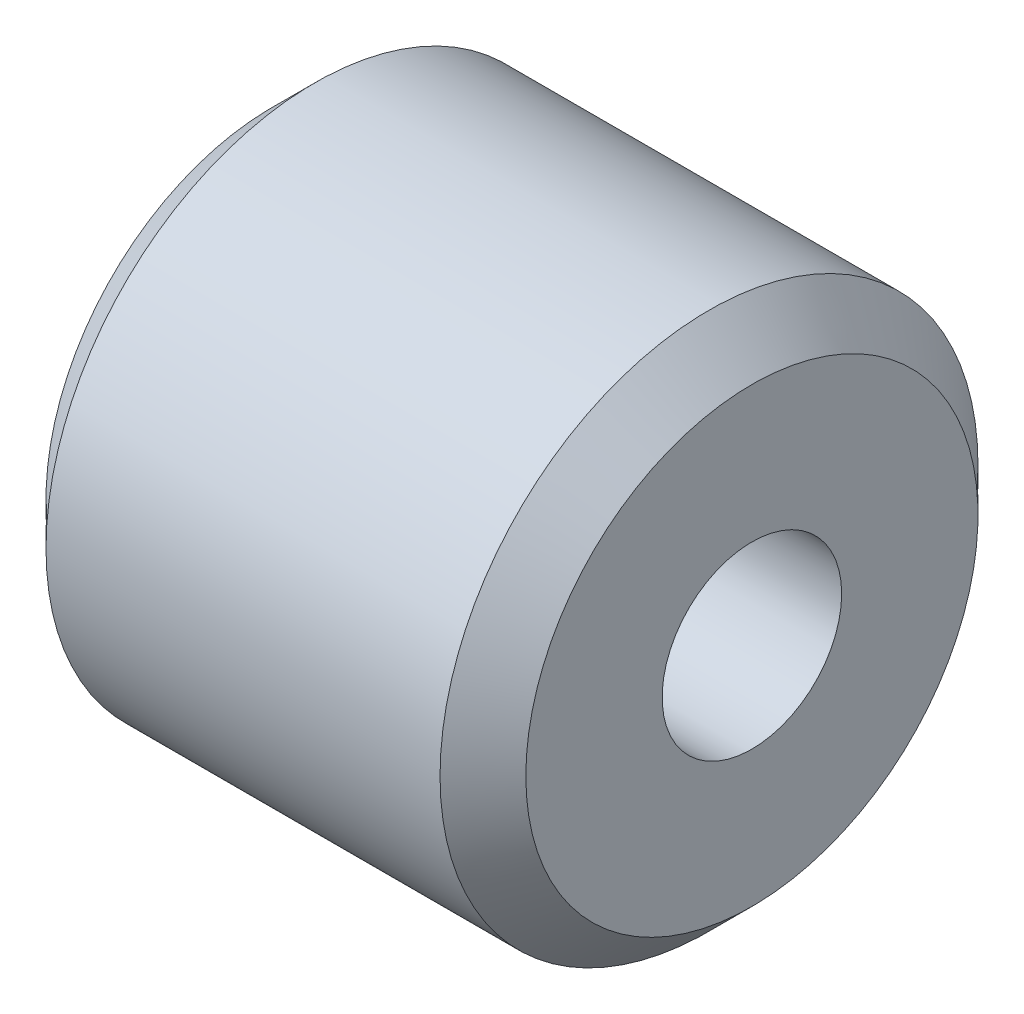
from build123d import *

# Parameters (mm, degrees)
SKETCH1_R           = 4.765
SKETCH1_R_2         = 1.59
BOSS_EXTRUDE1_DEPTH = 4.25
CHAMFER1_SIZE       = 0.76


with BuildPart() as part:
    # Sketch1 → Boss-Extrude1 (new, symmetric)
    with BuildSketch(Plane(origin=(0, 0, 0), x_dir=(0, 0, -1), z_dir=(1, 0, 0))):
        Circle(SKETCH1_R)
        Circle(SKETCH1_R_2, mode=Mode.SUBTRACT)
    extrude(amount=BOSS_EXTRUDE1_DEPTH, both=True)

    # Chamfer1
    chamfer1_edges = [part.edges().sort_by_distance(p)[0] for p in [
        (-4.25, 0, 4.765),
        (4.25, 0, 4.765),
    ]]
    chamfer(chamfer1_edges, length=CHAMFER1_SIZE)


solid = part.part
